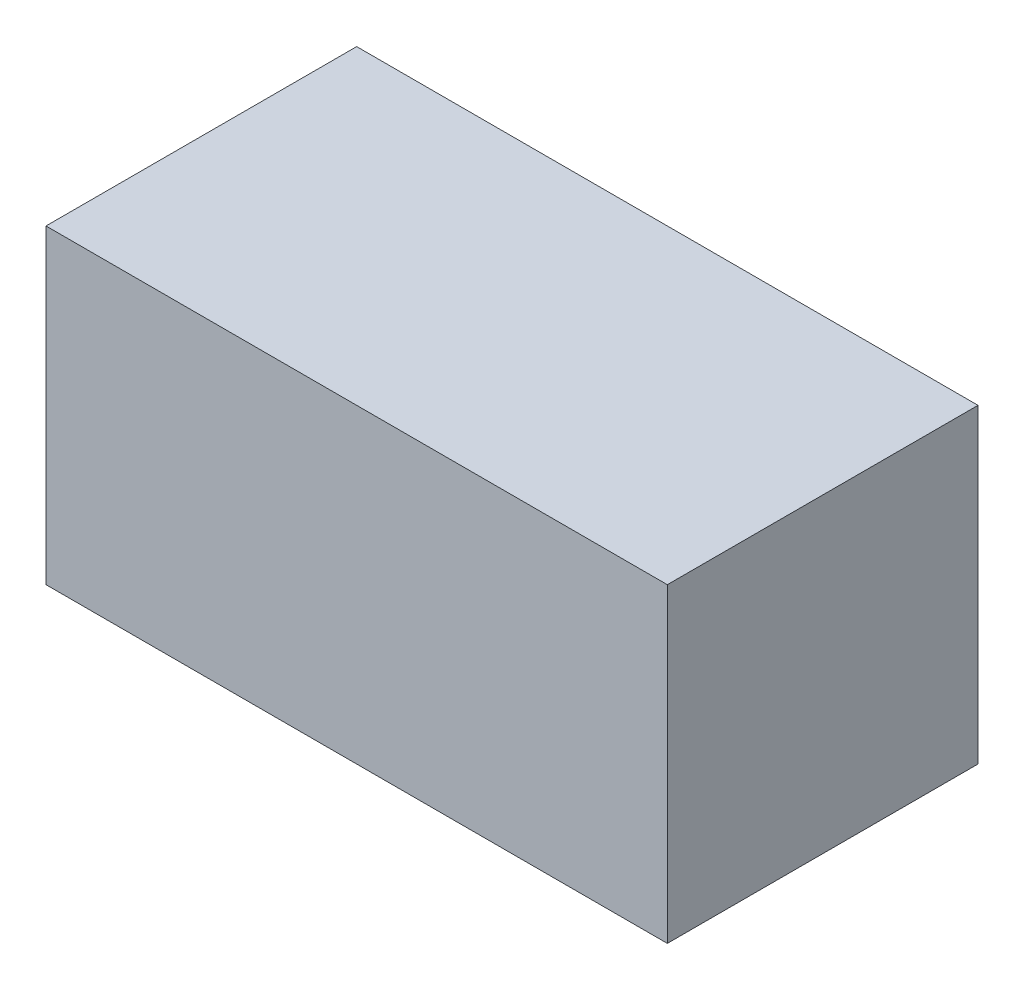
from build123d import *

# Parameters (mm, degrees)
ESQUISSE1_W      = 8
ESQUISSE1_H      = 4
EXTRUSION1_DEPTH = 4


with BuildPart() as part:
    # Esquisse1 → Extrusion1 (new body)
    with BuildSketch(Plane.XY):
        with Locations((4, 2)):
            Rectangle(ESQUISSE1_W, ESQUISSE1_H)
    extrude(amount=EXTRUSION1_DEPTH)


solid = part.part
